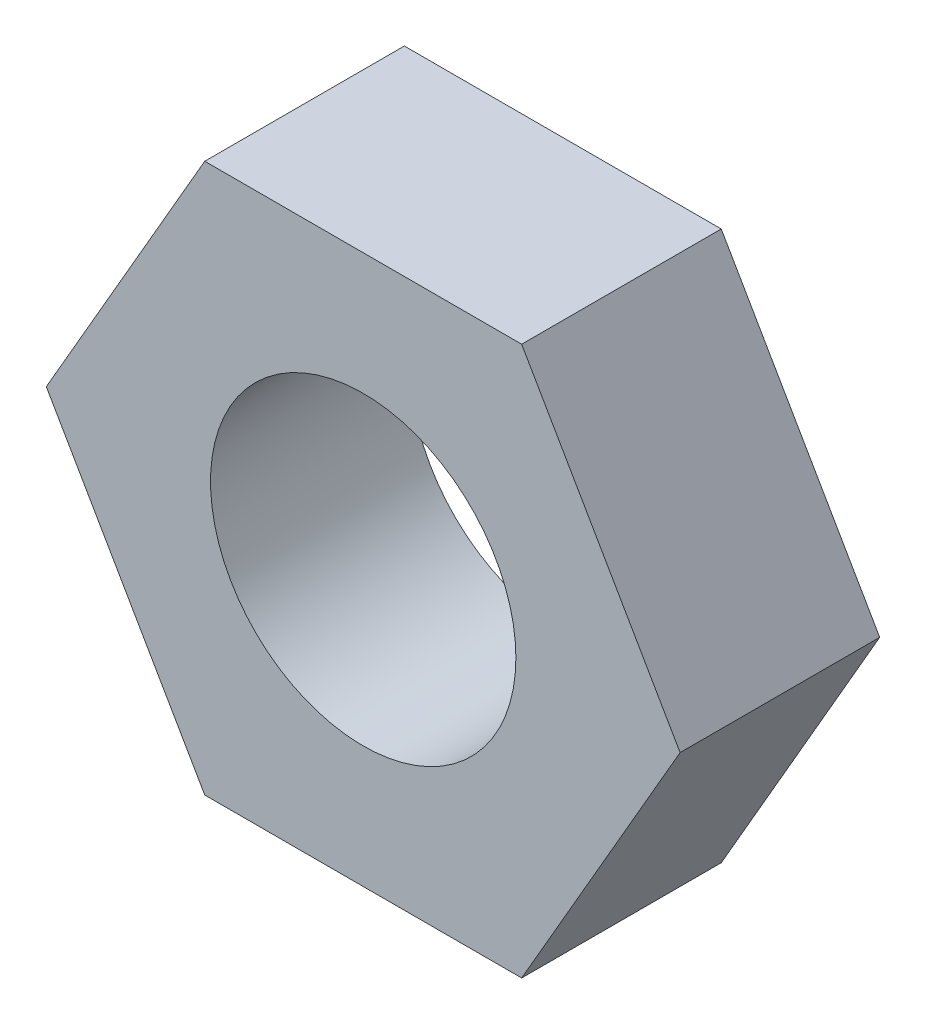
from build123d import *

# Parameters (mm, degrees)
S01_SMALL_HEX_LOCKING_NUT_R      = 1.53
F_01_SMALL_HEX_LOCKING_NUT_DEPTH = 2


with BuildPart() as part:
    # S01 - Small hex locking nut → 01 - Small hex locking nut (new body)
    with BuildSketch(Plane.XY):
        Polygon((3.175426481, 0), (1.58771324, 2.75), (-1.58771324, 2.75), (-3.175426481, 0), (-1.58771324, -2.75), (1.58771324, -2.75), align=None)
        Circle(S01_SMALL_HEX_LOCKING_NUT_R, mode=Mode.SUBTRACT)
    extrude(amount=F_01_SMALL_HEX_LOCKING_NUT_DEPTH)


solid = part.part
